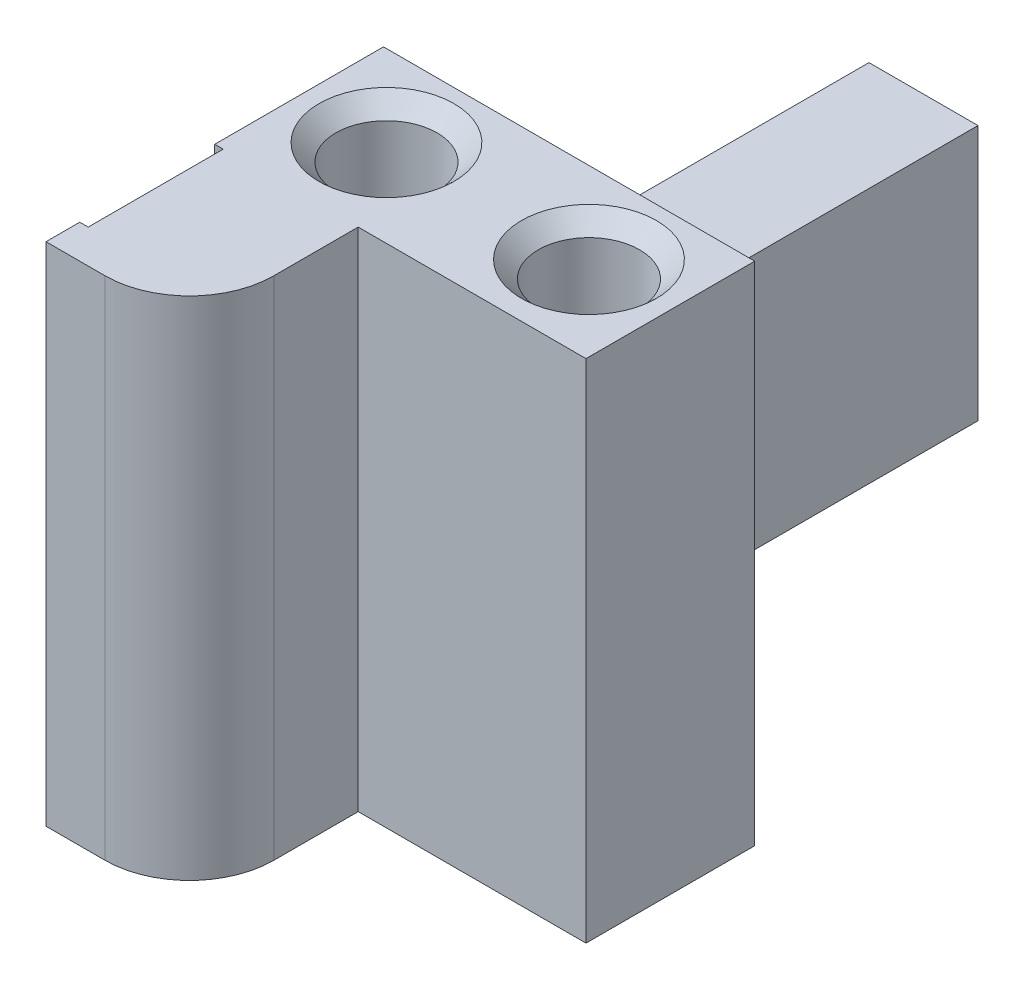
from build123d import *

# Parameters (mm, degrees)
SKETCH1_W           = 22
SKETCH1_H           = 30
BOSS_EXTRUDE1_DEPTH = 10
SKETCH2_R           = 3
CUT_EXTRUDE1_DEPTH  = 44
SKETCH3_W           = 8.5
SKETCH3_H           = 30
BOSS_EXTRUDE2_DEPTH = 10
SKETCH4_W           = 1.5
SKETCH4_H           = 1
CUT_EXTRUDE2_DEPTH  = 8
SKETCH5_W           = 6.460308978
SKETCH5_H           = 15.152222924
BOSS_EXTRUDE3_DEPTH = 21
CHAMFER1_SIZE       = 1
FILLET1_R           = 5


with BuildPart() as part:
    # Sketch1 → Boss-Extrude1 (new body)
    with BuildSketch(Plane.XY):
        Rectangle(SKETCH1_W, SKETCH1_H)
    extrude(amount=BOSS_EXTRUDE1_DEPTH)

    # Sketch2 → Cut-Extrude1 (cut)
    with BuildSketch(Plane(origin=(0, 15, 0), x_dir=(1, 0, 0), z_dir=(0, 1, 0))):
        with Locations(Location((-6, -4.824366767, 0), (0, 0, 270))):
            Circle(SKETCH2_R)
        with Locations(Location((6, -4.824366767, 0), (0, 0, 270))):
            Circle(SKETCH2_R)
    extrude(amount=-CUT_EXTRUDE1_DEPTH, mode=Mode.SUBTRACT)

    # Sketch3 → Boss-Extrude2 (add)
    with BuildSketch(Plane.XY.offset(10)):
        with Locations((-6.75, 0)):
            Rectangle(SKETCH3_W, SKETCH3_H)
    extrude(amount=BOSS_EXTRUDE2_DEPTH)

    # Sketch4 → Cut-Extrude2 (cut)
    with BuildSketch(Plane.XY.offset(18)):
        Polygon((-10.5, 14), (-10.5, 15), (-11, 15), (-11, -15), (-10.5, -15), (-10.5, -14), (-10.5, -13), (-10.5, -12), (-10.5, -11), (-10.5, -10), (-10.5, -9), (-10.5, -8), (-10.5, -7), (-10.5, -6), (-10.5, -5), (-10.5, -4), (-10.5, -3), (-10.5, -2), (-10.5, -1), (-10.5, 0), (-10.5, 1), (-10.5, 2), (-10.5, 3), (-10.5, 4), (-10.5, 5), (-10.5, 6), (-10.5, 7), (-10.5, 8), (-10.5, 9), (-10.5, 10), (-10.5, 11), (-10.5, 12), (-10.5, 13), align=None)
        with Locations((-9.75, 13.5)):
            Rectangle(SKETCH4_W, SKETCH4_H)
        with Locations((-9.75, 11.5)):
            Rectangle(SKETCH4_W, SKETCH4_H)
        with Locations((-9.75, 9.5)):
            Rectangle(SKETCH4_W, SKETCH4_H)
        with Locations((-9.75, 7.5)):
            Rectangle(SKETCH4_W, SKETCH4_H)
        with Locations((-9.75, 5.5)):
            Rectangle(SKETCH4_W, SKETCH4_H)
        with Locations((-9.75, 3.5)):
            Rectangle(SKETCH4_W, SKETCH4_H)
        with Locations((-9.75, 1.5)):
            Rectangle(SKETCH4_W, SKETCH4_H)
        with Locations((-9.75, -0.5)):
            Rectangle(SKETCH4_W, SKETCH4_H)
        with Locations((-9.75, -2.5)):
            Rectangle(SKETCH4_W, SKETCH4_H)
        with Locations((-9.75, -4.5)):
            Rectangle(SKETCH4_W, SKETCH4_H)
        with Locations((-9.75, -6.5)):
            Rectangle(SKETCH4_W, SKETCH4_H)
        with Locations((-9.75, -8.5)):
            Rectangle(SKETCH4_W, SKETCH4_H)
        with Locations((-9.75, -10.5)):
            Rectangle(SKETCH4_W, SKETCH4_H)
        with Locations((-9.75, -12.5)):
            Rectangle(SKETCH4_W, SKETCH4_H)
        with Locations((-9.75, -14.5)):
            Rectangle(SKETCH4_W, SKETCH4_H)
    extrude(amount=-CUT_EXTRUDE2_DEPTH, mode=Mode.SUBTRACT)

    # Sketch5 → Boss-Extrude3 (add)
    with BuildSketch(Plane(origin=(0, 0, 0), x_dir=(-1, 0, 0), z_dir=(0, 0, -1))):
        Rectangle(SKETCH5_W, SKETCH5_H)
    extrude(amount=BOSS_EXTRUDE3_DEPTH)

    # Chamfer1
    chamfer1_edges = [part.edges().sort_by_distance(p)[0] for p in [
        (-6, -15, 1.824366767),
        (-6, 15, 1.824366767),
        (6, -15, 1.824366767),
        (6, 15, 1.824366767),
    ]]
    chamfer(chamfer1_edges, length=CHAMFER1_SIZE)

    # Fillet1
    fillet1_edges = [part.edges().sort_by_distance(p)[0] for p in [
        (-2.5, 0, 20),
    ]]
    fillet(fillet1_edges, radius=FILLET1_R)


solid = part.part
